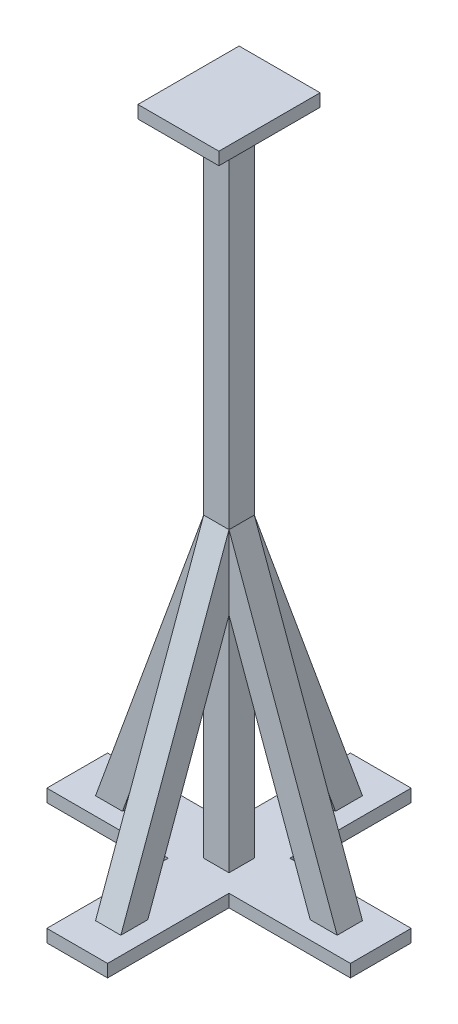
from build123d import *

# Parameters (mm, degrees)
BOSS_EXTRUDE1_DEPTH = 25
SKETCH3_W           = 50
SKETCH3_H           = 50
BOSS_EXTRUDE2_DEPTH = 1300
BOSS_EXTRUDE3_DEPTH = 50
CIRPATTERN1_COUNT   = 4
SKETCH7_W           = 160
SKETCH7_H           = 200
BOSS_EXTRUDE4_DEPTH = 25


with BuildPart() as part:
    # Sketch2 → Boss-Extrude1 (new body)
    with BuildSketch(Plane(origin=(0, 0, 0), x_dir=(1, 0, 0), z_dir=(0, 1, 0))):
        Polygon((-300, 60), (-60, 60), (-60, 300), (60, 300), (60, 60), (300, 60), (300, -60), (60, -60), (60, -300), (-60, -300), (-60, -60), (-300, -60), align=None)
    extrude(amount=BOSS_EXTRUDE1_DEPTH)

    # Sketch3 → Boss-Extrude2 (add)
    with BuildSketch(Plane.XZ):
        Rectangle(SKETCH3_W, SKETCH3_H)
    extrude(amount=-BOSS_EXTRUDE2_DEPTH)

    # Sketch7 → Boss-Extrude4 (add)
    with BuildSketch(Plane(origin=(0, 1300, 0), x_dir=(1, 0, 0), z_dir=(0, 1, 0))):
        Rectangle(SKETCH7_W, SKETCH7_H)
    extrude(amount=BOSS_EXTRUDE4_DEPTH)


with BuildPart() as body_2:
    # Sketch5 → Boss-Extrude3 (new body)
    with BuildSketch(Plane.XY.offset(25)):
        Polygon((25, 466.051563938), (185.52964105, 25), (238.738529674, 25), (25, 612.241783946), align=None)
    extrude(amount=-BOSS_EXTRUDE3_DEPTH)


with BuildPart() as cirpattern1_1:
    # CirPattern1: pattern copy
    add(body_2.part.rotate(Axis((0, 0, 0), (0, 1, 0)), 1 * 360 / CIRPATTERN1_COUNT))


with BuildPart() as cirpattern1_2:
    # CirPattern1: pattern copy
    add(body_2.part.rotate(Axis((0, 0, 0), (0, 1, 0)), 2 * 360 / CIRPATTERN1_COUNT))


with BuildPart() as cirpattern1_3:
    # CirPattern1: pattern copy
    add(body_2.part.rotate(Axis((0, 0, 0), (0, 1, 0)), 3 * 360 / CIRPATTERN1_COUNT))


solid = Compound([part.part, body_2.part, cirpattern1_1.part, cirpattern1_2.part, cirpattern1_3.part])
